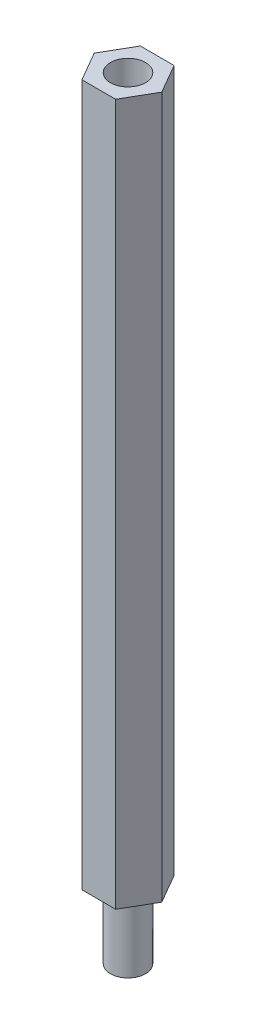
from build123d import *

# Parameters (mm, degrees)
CROQUIS1_R              = 1.5
SALIENTE_EXTRUIR1_DEPTH = 60
CROQUIS2_R              = 1.5
SALIENTE_EXTRUIR2_DEPTH = 6


with BuildPart() as part:
    # Croquis1 → Saliente-Extruir1 (new body)
    with BuildSketch(Plane(origin=(0, 0, 0), x_dir=(1, 0, 0), z_dir=(0, 1, 0))):
        Polygon((1.443375673, -2.5), (2.886751346, 0), (1.443375673, 2.5), (-1.443375673, 2.5), (-2.886751346, 0), (-1.443375673, -2.5), align=None)
        with Locations(Location((0, 0, 0), (0, 0, 270))):
            Circle(CROQUIS1_R, mode=Mode.SUBTRACT)
    extrude(amount=SALIENTE_EXTRUIR1_DEPTH)


with BuildPart() as body_2:
    # Croquis2 → Saliente-Extruir2 (new body)
    with BuildSketch(Plane.XZ):
        with Locations(Location((0, 0, 0), (0, 0, 270))):
            Circle(CROQUIS2_R)
    extrude(amount=SALIENTE_EXTRUIR2_DEPTH)


solid = Compound([part.part, body_2.part])
